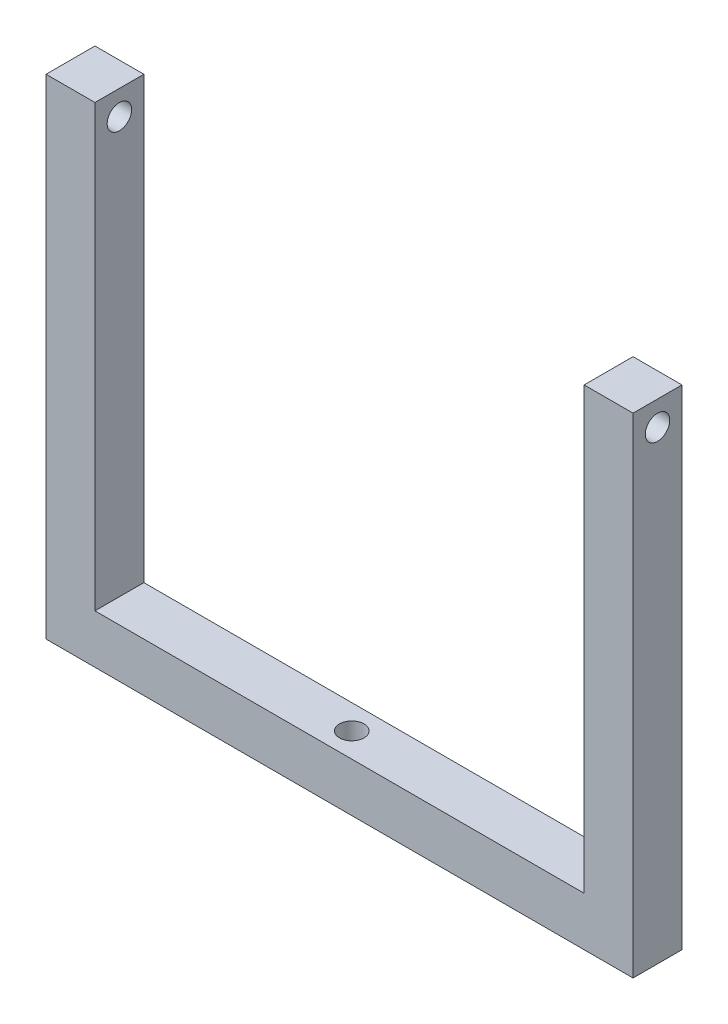
from build123d import *

# Parameters (mm, degrees)
BOSS_EXTRUDE1_DEPTH = 12.7
CUT_EXTRUDE1_REACH  = 200.786
SKETCH2_R           = 3.175
SKETCH3_R           = 3.175
CUT_EXTRUDE2_DEPTH  = 12.7


with BuildPart() as part:
    # Sketch1 → Boss-Extrude1 (new body)
    with BuildSketch(Plane.XY):
        Polygon((0, 0), (-12.7, 0), (-12.7, -127), (139.7, -127), (139.7, 0), (127, 0), (127, -114.3), (0, -114.3), align=None)
    extrude(amount=BOSS_EXTRUDE1_DEPTH)

    # Cut-Extrude1: up to this face of the body (flat: up to its plane)
    cut_extrude1_end = Plane(part.part.faces().sort_by_distance((139.7, -63.5, 6.35))[0])
    # Sketch2 → Cut-Extrude1 (cut, up to the picked face)
    with BuildSketch(Plane.ZY.offset(12.7), mode=Mode.PRIVATE) as cut_extrude1_sk1:
        with Locations(Location((6.35, -6.35, 0), (0, 0, 270))):
            Circle(SKETCH2_R)
    cut_extrude1_tool1 = split(extrude(cut_extrude1_sk1.sketch, amount=-CUT_EXTRUDE1_REACH, mode=Mode.PRIVATE), bisect_by=cut_extrude1_end, keep=Keep.BOTH, mode=Mode.PRIVATE)
    add(cut_extrude1_tool1.solids().sort_by(Axis((-12.7, -6.35, 6.35), (1, 0, 0)))[0], mode=Mode.SUBTRACT)

    # Sketch3 → Cut-Extrude2 (cut)
    with BuildSketch(Plane(origin=(0, -114.3, 0), x_dir=(1, 0, 0), z_dir=(0, 1, 0))):
        with Locations(Location((60.325, -6.35, 0), (0, 0, 180))):
            Circle(SKETCH3_R)
    extrude(amount=-CUT_EXTRUDE2_DEPTH, mode=Mode.SUBTRACT)


solid = part.part
